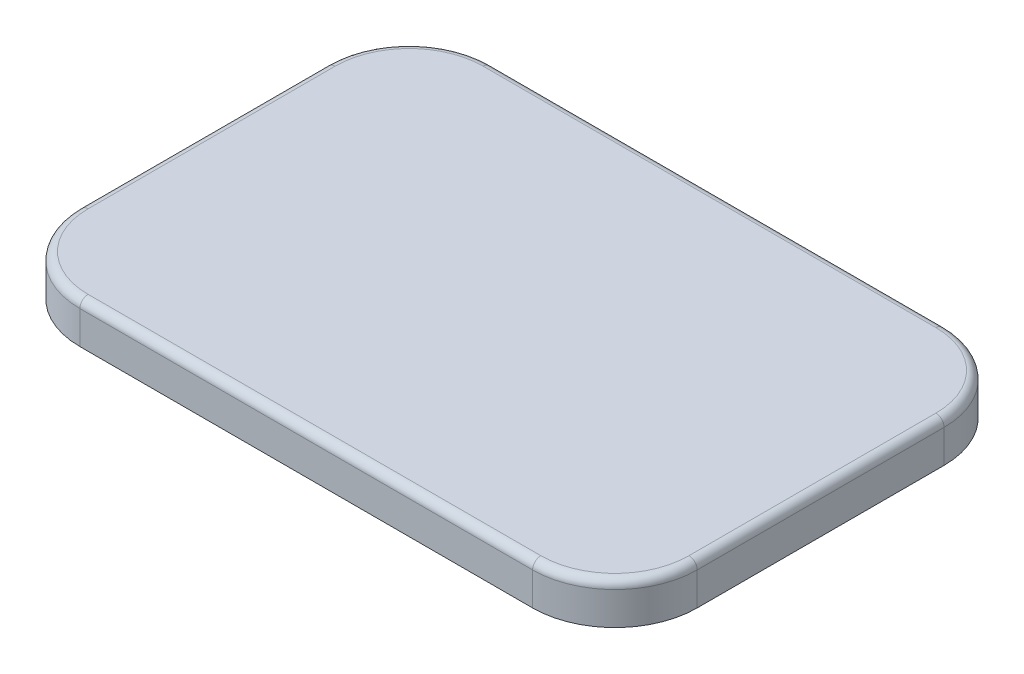
from build123d import *

# Parameters (mm, degrees)
BOSS_EXTRUDE1_DEPTH = 10
FILLET1_R           = 2


with BuildPart() as part:
    # Sketch2 → Boss-Extrude1 (new body)
    with BuildSketch(Plane(origin=(0, 0, 0), x_dir=(1, 0, 0), z_dir=(0, 1, 0))):
        with BuildLine():
            Line((55, -50), (-55, -50))
            ThreePointArc((-55, -50), (-69.142135624, -44.142135624), (-75, -30))
            Line((-75, -30), (-75, 30))
            ThreePointArc((-75, 30), (-69.142135624, 44.142135624), (-55, 50))
            Line((-55, 50), (55, 50))
            ThreePointArc((55, 50), (69.142135624, 44.142135624), (75, 30))
            Line((75, 30), (75, -30))
            ThreePointArc((75, -30), (69.142135624, -44.142135624), (55, -50))
        make_face()
    extrude(amount=BOSS_EXTRUDE1_DEPTH)

    # Fillet1
    fillet1_edges = [part.edges().sort_by_distance(p)[0] for p in [
        (69.142135624, 10, 44.142135624),
        (75, 10, 0),
        (69.142135624, 10, -44.142135624),
        (0, 10, -50),
        (-69.142135624, 10, -44.142135624),
        (-75, 10, 0),
        (-69.142135624, 10, 44.142135624),
        (0, 10, 50),
    ]]
    fillet(fillet1_edges, radius=FILLET1_R)


solid = part.part
